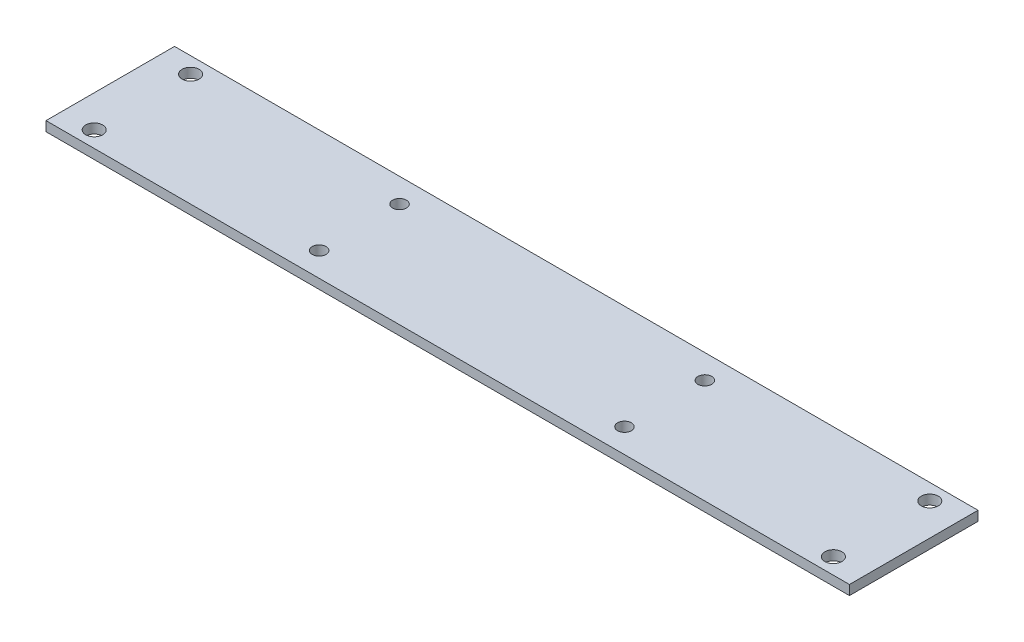
from build123d import *

# Parameters (mm, degrees)
SKETCH_1_W      = 250
SKETCH_1_H      = 40
SKETCH_1_R      = 2.15
SKETCH_1_R_2    = 2.65
EXTRUDE_1_DEPTH = 3


with BuildPart() as part:
    # 草图1 → 凸台-拉伸1 (new body)
    with BuildSketch(Plane(origin=(0, 0, 0), x_dir=(1, 0, 0), z_dir=(0, 1, 0))):
        Rectangle(SKETCH_1_W, SKETCH_1_H)
        with Locations(Location((-47.5, 12.5, 0), (0, 0, 270))):
            Circle(SKETCH_1_R, mode=Mode.SUBTRACT)
        with Locations(Location((47.5, 12.5, 0), (0, 0, 90))):
            Circle(SKETCH_1_R, mode=Mode.SUBTRACT)
        with Locations(Location((47.5, -12.5, 0), (0, 0, 270))):
            Circle(SKETCH_1_R, mode=Mode.SUBTRACT)
        with Locations(Location((-47.5, -12.5, 0), (0, 0, 90))):
            Circle(SKETCH_1_R, mode=Mode.SUBTRACT)
        with Locations(Location((-115, 15, 0), (0, 0, 270))):
            Circle(SKETCH_1_R_2, mode=Mode.SUBTRACT)
        with Locations(Location((115, 15, 0), (0, 0, 90))):
            Circle(SKETCH_1_R_2, mode=Mode.SUBTRACT)
        with Locations(Location((-115, -15, 0), (0, 0, 90))):
            Circle(SKETCH_1_R_2, mode=Mode.SUBTRACT)
        with Locations(Location((115, -15, 0), (0, 0, 270))):
            Circle(SKETCH_1_R_2, mode=Mode.SUBTRACT)
    extrude(amount=EXTRUDE_1_DEPTH)


solid = part.part
